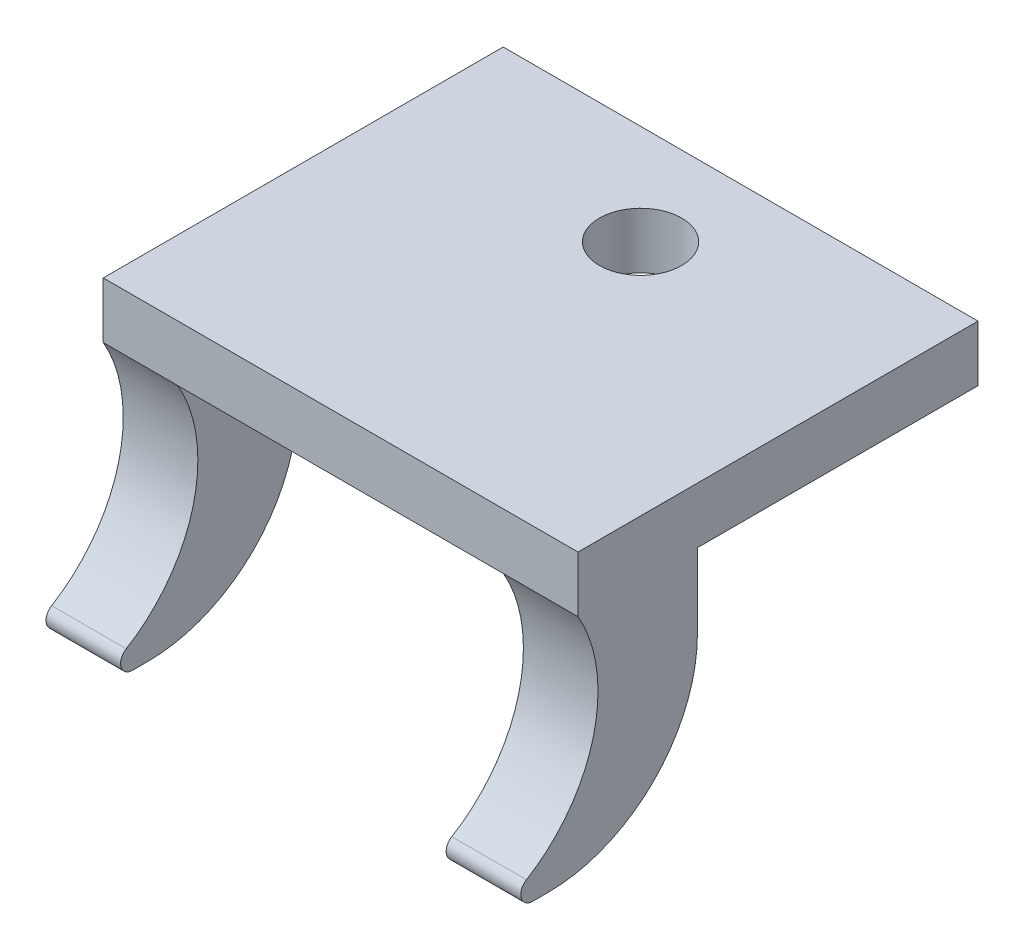
from build123d import *

# Parameters (mm, degrees)
SKETCH1_W            = 40.40124
SKETCH1_H            = 34.036
SKETCH1_R            = 1.257288094
BOSS_EXTRUDE1_DEPTH  = 4.7625
M6_CLEARANCE_HOLE1_D = 7
BOSS_EXTRUDE3_DEPTH  = 6.35
FILLET2_R            = 1
FILLET3_R            = 12.7


with BuildPart() as part:
    # Sketch1 → Boss-Extrude1 (new body)
    with BuildSketch(Plane(origin=(0, 0, 0), x_dir=(1, 0, 0), z_dir=(0, 1, 0))):
        with Locations((20.20062, 17.018)):
            Rectangle(SKETCH1_W, SKETCH1_H)
        with Locations(Location((20.20062, 25.522416525, 0), (0, 0, 90))):
            Circle(SKETCH1_R, mode=Mode.SUBTRACT)
    extrude(amount=BOSS_EXTRUDE1_DEPTH)

    # M6 Clearance Hole1 (through all)
    with Locations(Plane(origin=(0, 4.7625, 0), x_dir=(1, 0, 0), z_dir=(0, 1, 0))):
        with Locations((20.20062, 25.522416525)):
            Hole(M6_CLEARANCE_HOLE1_D / 2)

    # Sketch5 → Boss-Extrude3 (add)
    with BuildSketch(Plane(origin=(40.40124, 0, 0), x_dir=(0, 0, -1), z_dir=(1, 0, 0))):
        with BuildLine():
            Line((-10.998522628, -19.05), (10.16, -19.05))
            Line((10.16, -19.05), (10.16, 0))
            Line((10.16, 0), (0, 0))
            ThreePointArc((0, 0), (0, -12.7), (-10.998522628, -19.05))
        make_face()
    boss_extrude3 = extrude(amount=-BOSS_EXTRUDE3_DEPTH)

    # Mirror1: Boss-Extrude3 across plane
    add(boss_extrude3.mirror(Plane(origin=(20.20062, 0, 0), x_dir=(0, 0, 1), z_dir=(1, 0, 0))))

    # Fillet2
    fillet2_edges = [part.edges().sort_by_distance(p)[0] for p in [
        (37.22624, -19.05, 10.998522628),
        (3.175, -19.05, 10.998522628),
    ]]
    fillet(fillet2_edges, radius=FILLET2_R)

    # Fillet3
    fillet3_edges = [part.edges().sort_by_distance(p)[0] for p in [
        (37.22624, -19.05, -10.16),
        (3.175, -19.05, -10.16),
    ]]
    fillet(fillet3_edges, radius=FILLET3_R)


solid = part.part
